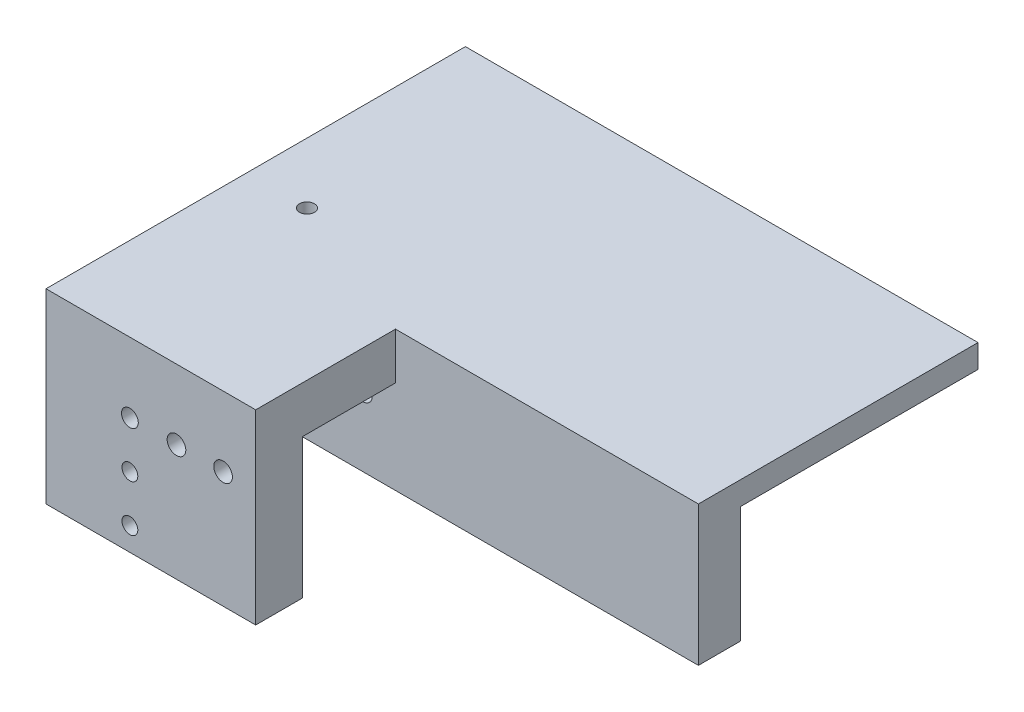
from build123d import *

# Parameters (mm, degrees)
SKETCH1_W               = 139.7
SKETCH1_H               = 76.2
BOSS_EXTRUDE1_DEPTH     = 38.1
CUT_EXTRUDE1_DEPTH      = 89.217019333
CUT_EXTRUDE1_DEPTH_BACK = 31.75
SKETCH3_R               = 2.032
CUT_EXTRUDE2_DEPTH      = 89.217019333
SKETCH4_W               = 52.07
SKETCH4_H               = 25.4
CUT_EXTRUDE3_DEPTH      = 10.414
SKETCH7_W               = 57.15
SKETCH7_H               = 12.7
BOSS_EXTRUDE2_DEPTH     = 25.4
SKETCH8_W               = 57.15
SKETCH8_H               = 50.8
BOSS_EXTRUDE3_DEPTH     = 12.7
SKETCH5_R               = 2.286
SKETCH5_R_2             = 2.54
CUT_EXTRUDE4_DEPTH      = 109.570070904
CUT_EXTRUDE5_DEPTH      = 14.986
CUT_EXTRUDE6_DEPTH      = 7.112
SKETCH10_R              = 2.159
CUT_EXTRUDE7_DEPTH      = 139.84509874
SKETCH11_W              = 52.07
SKETCH11_H              = 6.35
BOSS_EXTRUDE4_DEPTH     = 25.4


with BuildPart() as part:
    # Sketch1 → Boss-Extrude1 (new body)
    with BuildSketch(Plane(origin=(0, 0, 0), x_dir=(1, 0, 0), z_dir=(0, 1, 0))):
        Rectangle(SKETCH1_W, SKETCH1_H)
    extrude(amount=-BOSS_EXTRUDE1_DEPTH)

    # Sketch2 → Cut-Extrude1 (cut, two sides: drawn at the far end of the back side and taken through both)
    with BuildSketch(Plane.XZ.offset(38.1).offset(-CUT_EXTRUDE1_DEPTH_BACK)):
        Polygon((387.819108191, 26.67), (69.85, 26.67), (7.62, 26.67), (7.62, 0), (-58.42, 0), (-58.42, -38.1), (-58.42, -356.069108191), (355.598009183, -838.77657978), (801.837117374, -456.037471588), align=None)
    extrude(amount=CUT_EXTRUDE1_DEPTH + CUT_EXTRUDE1_DEPTH_BACK, mode=Mode.SUBTRACT)

    # Sketch3 → Cut-Extrude2 (cut, through all)
    with BuildSketch(Plane.XZ.offset(38.1)):
        with Locations(Location((-53.34, 21.59, 0), (0, 0, 270))):
            Circle(SKETCH3_R)
    extrude(amount=-CUT_EXTRUDE2_DEPTH, mode=Mode.SUBTRACT)

    # Sketch4 → Cut-Extrude3 (cut)
    with BuildSketch(Plane(origin=(0, 0, 0), x_dir=(-1, 0, 0), z_dir=(0, 0, -1))):
        with Locations((32.385, -19.05)):
            Rectangle(SKETCH4_W, SKETCH4_H)
    extrude(amount=-CUT_EXTRUDE3_DEPTH, mode=Mode.SUBTRACT)

    # Sketch7 → Boss-Extrude2 (add)
    with BuildSketch(Plane.XY.offset(38.1)):
        with Locations((-41.275, -6.35)):
            Rectangle(SKETCH7_W, SKETCH7_H)
    extrude(amount=BOSS_EXTRUDE2_DEPTH)

    # Sketch8 → Boss-Extrude3 (add)
    with BuildSketch(Plane.XY.offset(63.5)):
        with Locations((-41.275, -25.4)):
            Rectangle(SKETCH8_W, SKETCH8_H)
    extrude(amount=BOSS_EXTRUDE3_DEPTH)

    # Sketch5 → Cut-Extrude4 (cut, through all)
    with BuildSketch(Plane(origin=(0, 0, 10.414), x_dir=(-1, 0, 0), z_dir=(0, 0, -1))):
        with Locations((46.99, -19.05)):
            Circle(SKETCH5_R)
        with Locations((34.29, -19.05)):
            Circle(SKETCH5_R_2)
        with Locations((21.59, -19.05)):
            Circle(SKETCH5_R_2)
    extrude(amount=-CUT_EXTRUDE4_DEPTH, mode=Mode.SUBTRACT)

    # Sketch6 → Cut-Extrude5 (cut)
    with BuildSketch(Plane(origin=(0, 0, 10.414), x_dir=(-1, 0, 0), z_dir=(0, 0, -1))):
        with BuildLine():
            Line((27.051, -18.288), (26.612524863, -18.288))
            ThreePointArc((26.612524863, -18.288), (16.51, -19.05), (26.612524863, -19.812))
            Line((26.612524863, -19.812), (27.051, -19.812))
            Line((27.051, -19.812), (27.051, -21.082))
            Line((27.051, -21.082), (28.829, -21.082))
            Line((28.829, -21.082), (28.829, -19.812))
            Line((28.829, -19.812), (29.267475137, -19.812))
            ThreePointArc((29.267475137, -19.812), (39.37, -19.05), (29.267475137, -18.288))
            Line((29.267475137, -18.288), (28.829, -18.288))
            Line((28.829, -18.288), (28.829, -17.018))
            Line((28.829, -17.018), (27.051, -17.018))
            Line((27.051, -17.018), (27.051, -18.288))
        make_face()
    extrude(amount=-CUT_EXTRUDE5_DEPTH, mode=Mode.SUBTRACT)

    # Sketch9 → Cut-Extrude6 (cut)
    with BuildSketch(Plane(origin=(0, 0, 63.5), x_dir=(-1, 0, 0), z_dir=(0, 0, -1))):
        Polygon((42.323188216, -16.865376771), (42.323188216, -46.634623229), (44.704, -49.276), (49.276, -49.276), (51.656811784, -46.634623229), (51.656811784, -16.865376771), (49.276, -14.224), (44.704, -14.224), align=None)
    extrude(amount=-CUT_EXTRUDE6_DEPTH, mode=Mode.SUBTRACT)

    # Sketch10 → Cut-Extrude7 (cut, through all)
    with BuildSketch(Plane(origin=(0, 0, 70.612), x_dir=(-1, 0, 0), z_dir=(0, 0, -1))):
        with Locations((46.99, -19.05)):
            Circle(SKETCH10_R)
        with Locations((46.99, -31.75)):
            Circle(SKETCH10_R)
        with Locations((46.99, -44.45)):
            Circle(SKETCH10_R)
    extrude(amount=-CUT_EXTRUDE7_DEPTH, mode=Mode.SUBTRACT)

    # Sketch11 → Boss-Extrude4 (add)
    with BuildSketch(Plane(origin=(0, 0, 0), x_dir=(-1, 0, 0), z_dir=(0, 0, -1))):
        with Locations((32.385, -34.925)):
            Rectangle(SKETCH11_W, SKETCH11_H)
    extrude(amount=BOSS_EXTRUDE4_DEPTH)


solid = part.part
